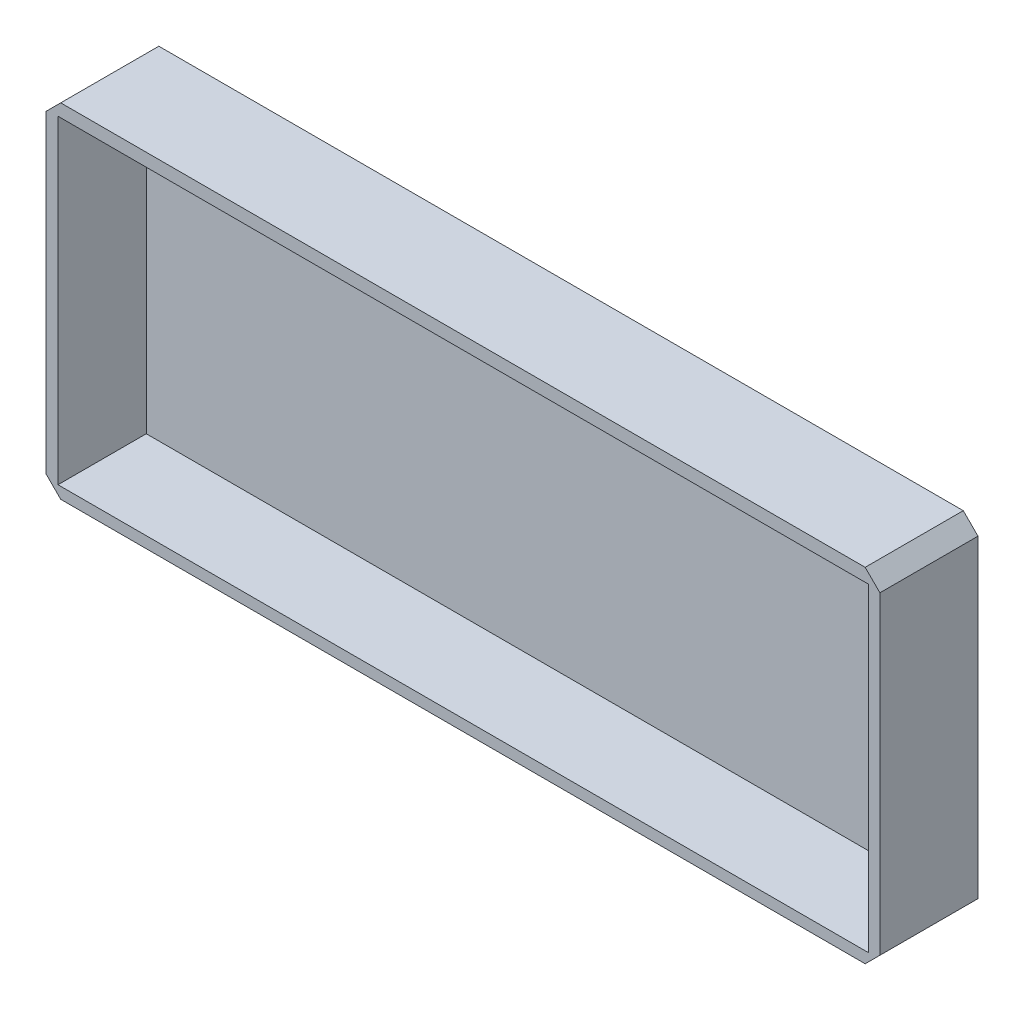
from build123d import *

# Parameters (mm, degrees)
SKETCH1_W           = 170
SKETCH1_H           = 70
BOSS_EXTRUDE1_DEPTH = 20
SKETCH2_W           = 165.280045526
SKETCH2_H           = 65.058846286
CUT_EXTRUDE1_DEPTH  = 18
CHAMFER1_SIZE       = 3


with BuildPart() as part:
    # Sketch1 → Boss-Extrude1 (new body)
    with BuildSketch(Plane.XY):
        with Locations((85, -35)):
            Rectangle(SKETCH1_W, SKETCH1_H)
    extrude(amount=BOSS_EXTRUDE1_DEPTH)

    # Sketch2 → Cut-Extrude1 (cut)
    with BuildSketch(Plane.XY.offset(20)):
        with Locations((85.08493322, -35.169866439)):
            Rectangle(SKETCH2_W, SKETCH2_H)
    extrude(amount=-CUT_EXTRUDE1_DEPTH, mode=Mode.SUBTRACT)

    # Chamfer1
    chamfer1_edges = [part.edges().sort_by_distance(p)[0] for p in [
        (0, 0, 10),
        (170, 0, 10),
        (170, -70, 10),
        (0, -70, 10),
    ]]
    chamfer(chamfer1_edges, length=CHAMFER1_SIZE)


solid = part.part
